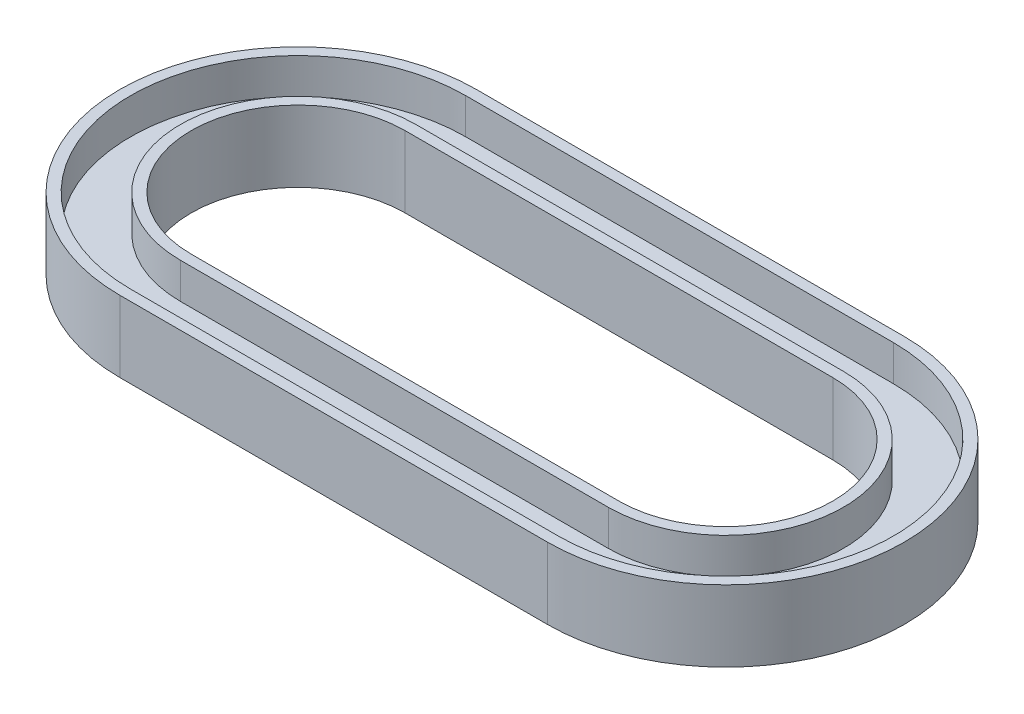
from build123d import *

# Parameters (mm, degrees)
EXTRUDE_3_DEPTH = 10
EXTRUDE_4_DEPTH = 20


with BuildPart() as part:
    # 草圖1 → 填料-伸長3 (new body)
    with BuildSketch(Plane(origin=(0, 0, 0), x_dir=(1, 0, 0), z_dir=(0, 1, 0))):
        with BuildLine():
            Line((-60, 50), (60, 50))
            ThreePointArc((60, 50), (110, 0), (60, -50))
            Line((60, -50), (-60, -50))
            ThreePointArc((-60, -50), (-110, 0), (-60, 50))
        make_face()
        with BuildLine():
            Line((-60, -30), (60, -30))
            ThreePointArc((60, -30), (90, 0), (60, 30))
            Line((60, 30), (-60, 30))
            ThreePointArc((-60, 30), (-90, 0), (-60, -30))
        make_face(mode=Mode.SUBTRACT)
    extrude(amount=EXTRUDE_3_DEPTH)

    # 草圖4 → 填料-伸長4 (add)
    # profile 1 of 2: a face of its own
    with BuildSketch(Plane(origin=(0, 0, 0), x_dir=(1, 0, 0), z_dir=(0, 1, 0))):
        with BuildLine():
            Line((-60, 50), (60, 50))
            ThreePointArc((60, 50), (110, 0), (60, -50))
            Line((60, -50), (-60, -50))
            ThreePointArc((-60, -50), (-110, 0), (-60, 50))
        make_face()
        with BuildLine():
            ThreePointArc((60, -47), (107, 0), (60, 47))
            Line((60, 47), (-60, 47))
            ThreePointArc((-60, 47), (-107, 0), (-60, -47))
            Line((-60, -47), (60, -47))
        make_face(mode=Mode.SUBTRACT)
    # profile 2 of 2: a face of its own
    with BuildSketch(Plane(origin=(0, 0, 0), x_dir=(1, 0, 0), z_dir=(0, 1, 0))):
        with BuildLine():
            Line((-60, 33), (60, 33))
            ThreePointArc((60, 33), (93, 0), (60, -33))
            Line((60, -33), (-60, -33))
            ThreePointArc((-60, -33), (-93, 0), (-60, 33))
        make_face()
        with BuildLine():
            ThreePointArc((-60, 30), (-90, 0), (-60, -30))
            Line((-60, -30), (60, -30))
            ThreePointArc((60, -30), (90, 0), (60, 30))
            Line((60, 30), (-60, 30))
        make_face(mode=Mode.SUBTRACT)
    extrude(amount=EXTRUDE_4_DEPTH)


solid = part.part
